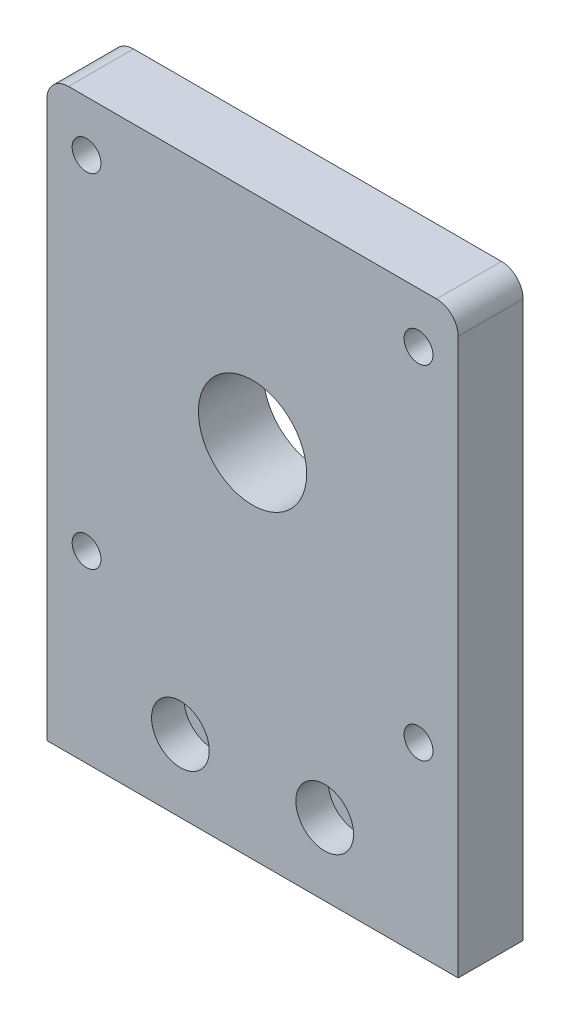
from build123d import *

# Parameters (mm, degrees)
CROQUIS1_R              = 7.5
CROQUIS1_R_2            = 2
SALIENTE_EXTRUIR1_DEPTH = 9
CROQUIS2_R              = 4
CORTAR_EXTRUIR1_DEPTH   = 4.5


with BuildPart() as part:
    # Croquis1 → Saliente-Extruir1 (new body)
    with BuildSketch(Plane.XY):
        with BuildLine():
            Line((-25.5, 40), (25.5, 40))
            ThreePointArc((25.5, 40), (27.621320344, 39.121320344), (28.5, 37))
            Line((28.5, 37), (28.5, -40))
            Line((28.5, -40), (-28.5, -40))
            Line((-28.5, -40), (-28.5, 37))
            ThreePointArc((-28.5, 37), (-27.621320344, 39.121320344), (-25.5, 40))
        make_face()
        with Locations((0, 10)):
            Circle(CROQUIS1_R, mode=Mode.SUBTRACT)
        with Locations((10, -30)):
            Circle(CROQUIS1_R_2, mode=Mode.SUBTRACT)
        with Locations((-10, -30)):
            Circle(CROQUIS1_R_2, mode=Mode.SUBTRACT)
        with Locations((-23, 33)):
            Circle(CROQUIS1_R_2, mode=Mode.SUBTRACT)
        with Locations((-23, -14.5)):
            Circle(CROQUIS1_R_2, mode=Mode.SUBTRACT)
        with Locations(Location((23, -14.5, 0), (0, 0, 180))):
            Circle(CROQUIS1_R_2, mode=Mode.SUBTRACT)
        with Locations(Location((23, 33, 0), (0, 0, 180))):
            Circle(CROQUIS1_R_2, mode=Mode.SUBTRACT)
    extrude(amount=SALIENTE_EXTRUIR1_DEPTH)

    # Croquis2 → Cortar-Extruir1 (cut)
    with BuildSketch(Plane.XY.offset(9)):
        with Locations((-10, -30)):
            Circle(CROQUIS2_R)
        with Locations((10, -30)):
            Circle(CROQUIS2_R)
    extrude(amount=-CORTAR_EXTRUIR1_DEPTH, mode=Mode.SUBTRACT)


solid = part.part
